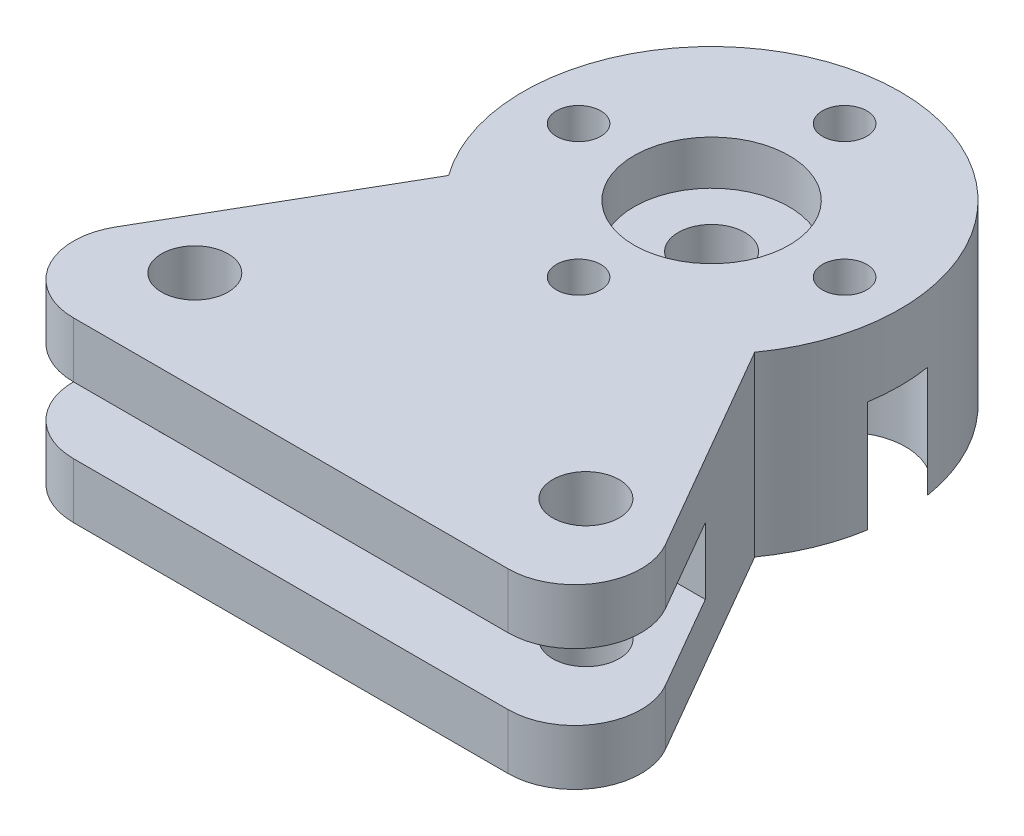
from build123d import *

# Parameters (mm, degrees)
SKETCH1_R           = 1.5
BOSS_EXTRUDE1_DEPTH = 8
SKETCH2_W           = 26.485934179
SKETCH2_H           = 3
CUT_EXTRUDE3_DEPTH  = 8.75
SKETCH3_R           = 8.5
SKETCH3_R_2         = 1.5
SKETCH3_R_3         = 1
BOSS_EXTRUDE2_DEPTH = 8
SKETCH4_R           = 2.75
CUT_EXTRUDE4_DEPTH  = 5
SKETCH5_R           = 3.5
CUT_EXTRUDE5_DEPTH  = 2
SKETCH3_3_R         = 1
CUT_EXTRUDE6_DEPTH  = 32


with BuildPart() as part:
    # Sketch1 → Boss-Extrude1 (new body)
    with BuildSketch(Plane(origin=(0, 0, 0), x_dir=(1, 0, 0), z_dir=(0, 1, 0))):
        with BuildLine():
            Line((-2.598076211, 12.820508076), (-12.401923789, -4.160254038))
            ThreePointArc((-12.401923789, -4.160254038), (-12.401923789, -7.160254038), (-9.803847577, -8.660254038))
            Line((-9.803847577, -8.660254038), (9.803847577, -8.660254038))
            ThreePointArc((9.803847577, -8.660254038), (12.401923789, -7.160254038), (12.401923789, -4.160254038))
            Line((12.401923789, -4.160254038), (2.598076211, 12.820508076))
            ThreePointArc((2.598076211, 12.820508076), (0, 14.320508076), (-2.598076211, 12.820508076))
        make_face()
        with Locations(Location((0, 10.320508076, 0), (0, 0, 270))):
            Circle(SKETCH1_R, mode=Mode.SUBTRACT)
        with Locations(Location((-8.82025404, -4.169491924, 0), (0, 0, 270))):
            Circle(SKETCH1_R, mode=Mode.SUBTRACT)
        with Locations(Location((8.82025404, -4.169491924, 0), (0, 0, 90))):
            Circle(SKETCH1_R, mode=Mode.SUBTRACT)
    extrude(amount=BOSS_EXTRUDE1_DEPTH)

    # Sketch2 → Cut-Extrude3 (cut)
    with BuildSketch(Plane.XY.offset(8.660254038)):
        with Locations((0.054095799, 4)):
            Rectangle(SKETCH2_W, SKETCH2_H)
    extrude(amount=-CUT_EXTRUDE3_DEPTH, mode=Mode.SUBTRACT)

    # Sketch3 → Boss-Extrude2 (add)
    with BuildSketch(Plane(origin=(0, 0, 0), x_dir=(-1, 0, 0), z_dir=(0, -1, 0))):
        with Locations((0, 10.320508076)):
            Circle(SKETCH3_R)
        with Locations(Location((0, 10.320508076, 0), (0, 0, 270))):
            Circle(SKETCH3_R_2, mode=Mode.SUBTRACT)
        with Locations(Location((-6, 10.320508076, 0), (0, 0, 90))):
            Circle(SKETCH3_R_3, mode=Mode.SUBTRACT)
        with Locations(Location((6, 10.320508076, 0), (0, 0, 90))):
            Circle(SKETCH3_R_3, mode=Mode.SUBTRACT)
        with Locations(Location((0, 16.320508076, 0), (0, 0, 90))):
            Circle(SKETCH3_R_3, mode=Mode.SUBTRACT)
        with Locations((0, 4.320508076)):
            Circle(SKETCH3_R_3, mode=Mode.SUBTRACT)
    extrude(amount=-BOSS_EXTRUDE2_DEPTH)

    # Sketch4 → Cut-Extrude4 (cut)
    with BuildSketch(Plane.XZ):
        with Locations((-6, -10.320508076)):
            Circle(SKETCH4_R)
        with Locations((6, -10.320508076)):
            Circle(SKETCH4_R)
        with Locations((0, -16.320508076)):
            Circle(SKETCH4_R)
        with Locations(Location((0, -4.320508076, 0), (0, 0, 90))):
            Circle(SKETCH4_R)
    extrude(amount=-CUT_EXTRUDE4_DEPTH, mode=Mode.SUBTRACT)

    # Sketch5 → Cut-Extrude5 (cut)
    with BuildSketch(Plane(origin=(0, 8, 0), x_dir=(1, 0, 0), z_dir=(0, 1, 0))):
        with Locations(Location((0, 10.320508076, 0), (0, 0, 270))):
            Circle(SKETCH5_R)
    extrude(amount=-CUT_EXTRUDE5_DEPTH, mode=Mode.SUBTRACT)

    # Sketch3<3> → Cut-Extrude6 (cut)
    with BuildSketch(Plane(origin=(0, 0, 0), x_dir=(-1, 0, 0), z_dir=(0, -1, 0))):
        with Locations(Location((0, 4.320508076, 0), (0, 0, 270))):
            Circle(SKETCH3_3_R)
    extrude(amount=-CUT_EXTRUDE6_DEPTH, mode=Mode.SUBTRACT)


solid = part.part
